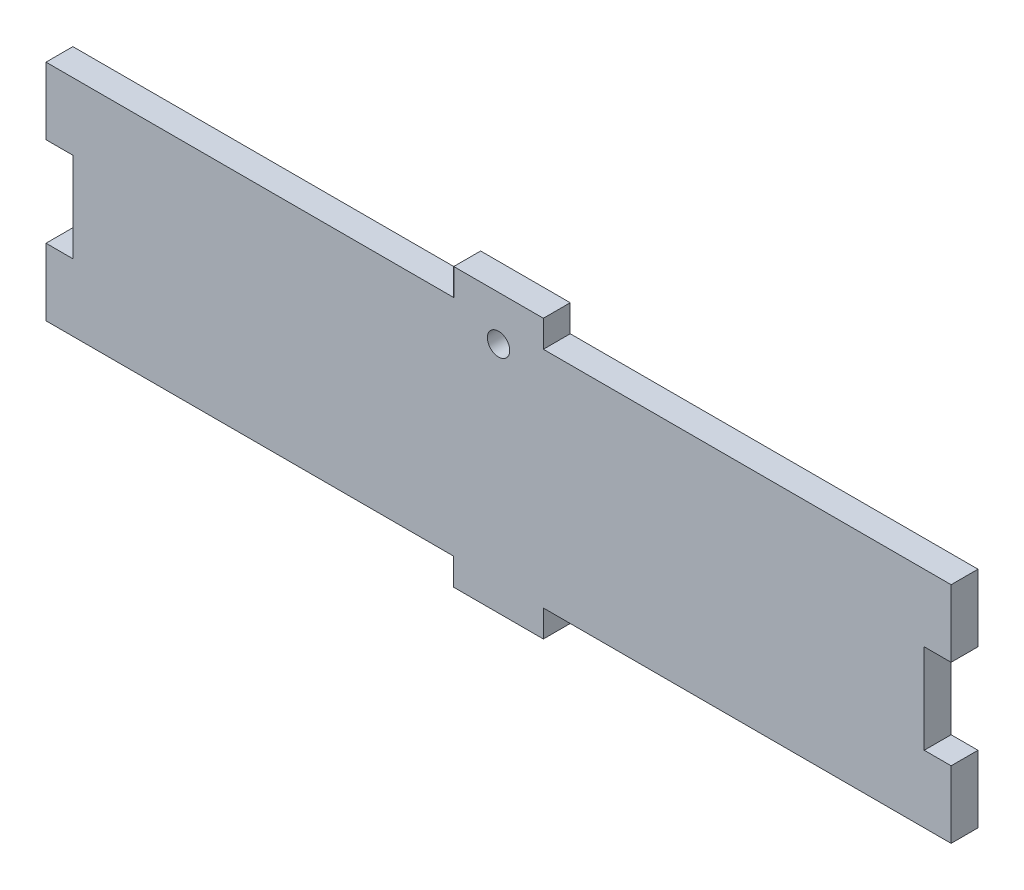
from build123d import *

# Parameters (mm, degrees)
BOSS_EXTRU_2_DEPTH      = 6
ESQUISSE7_W             = 20
ESQUISSE7_H             = 6
ESQUISSE7_W_2           = 6
ESQUISSE7_H_2           = 15
BOSS_EXTRU_3_DEPTH      = 6
ESQUISSE8_R             = 2.5
ENL_V_MAT_EXTRU_2_DEPTH = 6


with BuildPart() as part:
    # Esquisse6 → Boss.-Extru.2 (new body)
    with BuildSketch(Plane.XY):
        Polygon((12.003078089, 22.295844579), (97.003078089, 22.295844579), (97.003078089, 7.295844579), (97.003078089, -12.704155421), (97.003078089, -27.704155421), (12.003078089, -27.704155421), (-7.996921911, -27.704155421), (-92.996921911, -27.704155421), (-92.996921911, -12.704155421), (-92.996921911, 7.295844579), (-92.996921911, 22.295844579), (-7.996921911, 22.295844579), align=None)
    extrude(amount=-BOSS_EXTRU_2_DEPTH)

    # Esquisse7 → Boss.-Extru.3 (add)
    with BuildSketch(Plane.XY):
        with Locations((2.003078089, 25.295844579)):
            Rectangle(ESQUISSE7_W, ESQUISSE7_H)
        with Locations((100.003078089, 14.795844579)):
            Rectangle(ESQUISSE7_W_2, ESQUISSE7_H_2)
        with Locations((100.003078089, -20.204155421)):
            Rectangle(ESQUISSE7_W_2, ESQUISSE7_H_2)
        with Locations((2.003078089, -30.704155421)):
            Rectangle(ESQUISSE7_W, ESQUISSE7_H)
        with Locations((-95.996921911, -20.204155421)):
            Rectangle(ESQUISSE7_W_2, ESQUISSE7_H_2)
        with Locations((-95.996921911, 14.795844579)):
            Rectangle(ESQUISSE7_W_2, ESQUISSE7_H_2)
    extrude(amount=-BOSS_EXTRU_3_DEPTH)

    # Esquisse8 → Enlèv. mat.-Extru.2 (cut)
    with BuildSketch(Plane.XY):
        with Locations((2.003078089, 18.295844579)):
            Circle(ESQUISSE8_R)
    extrude(amount=-ENL_V_MAT_EXTRU_2_DEPTH, mode=Mode.SUBTRACT)


solid = part.part
